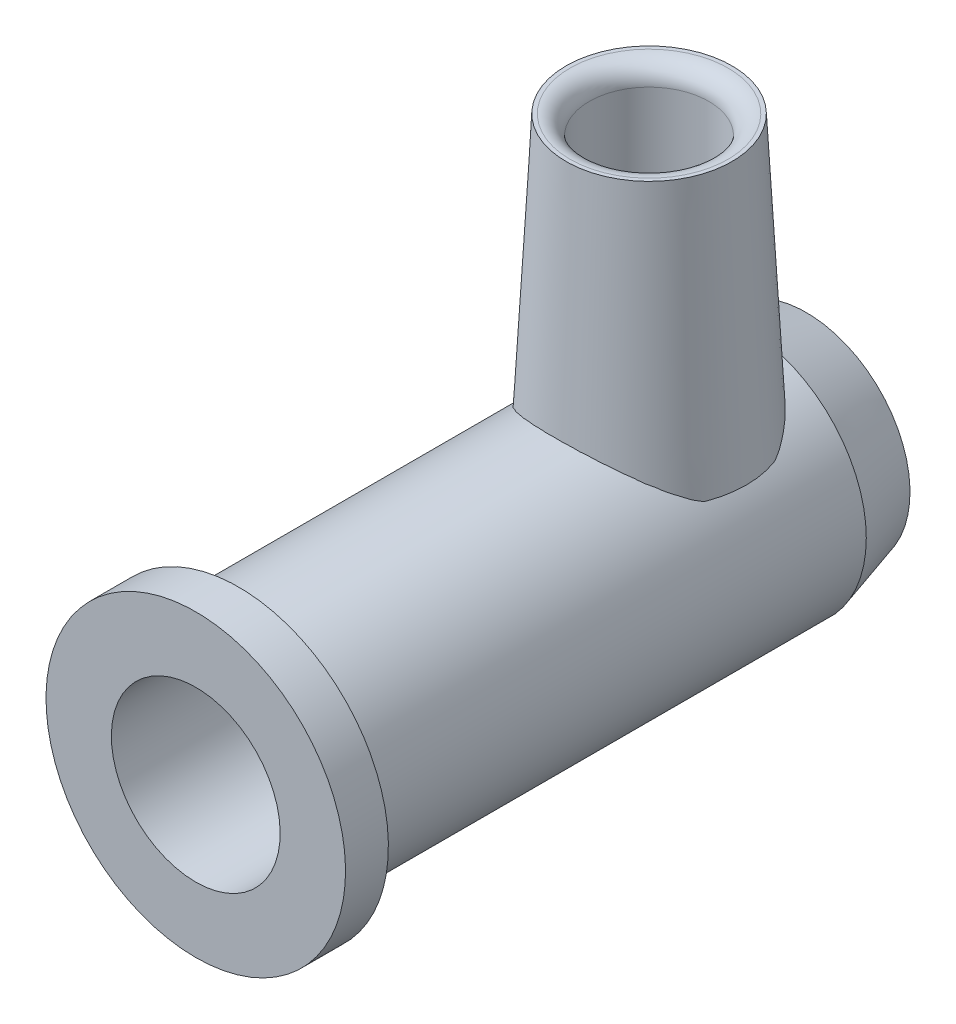
from build123d import *

# Parameters (mm, degrees)
BOSS_EXTRUDE1_DEPTH           = 1
CUT_EXTRUDE1_DEPTH            = 8.5
SKETCH12_R                    = 3.045
SKETCH12_R_2                  = 2.23165
BOSS_EXTRUDE2_DEPTH           = 8.69
SKETCH15_R                    = 3.552
SKETCH15_R_2                  = 2.23165
BOSS_EXTRUDE4_DEPTH           = 8.69
BOSS_EXTRUDE4_TAPER           = 3
BOSS_EXTRUDE4_OTHER_WAY_DEPTH = 1.5
BOSS_EXTRUDE4_OTHER_WAY_TAPER = -3
FILLET2_R                     = 0.7185


with BuildPart() as part:
    # Sketch1 → Revolve1 (revolve)
    with BuildSketch(Plane.YZ):
        Polygon((10.985518673, 23.682686896), (13.425518673, 23.682686896), (13.425518673, 0.892686896), (12.705518673, 0.892686896), (12.03485673, 3.194686896), (12.03485673, 22.082686896), (10.985518673, 22.082686896), align=None)
    revolve(axis=Axis((0, 16.575518673, 25.765129309), (0, 0, -1)))

    # Sketch7 → Boss-Extrude1 (add)
    with BuildSketch(Plane(origin=(0, 21.116180616, 0.892686896), x_dir=(1, 0, 0), z_dir=(0, 1, 0))):
        with BuildLine():
            ThreePointArc((2.23165, -5.87), (1.578014848, -4.291985152), (0, -3.63835))
            ThreePointArc((0, -3.63835), (-1.578014848, -7.448014848), (2.23165, -5.87))
        make_face()
        with BuildLine():
            ThreePointArc((1.54, -5.87), (-1.088944443, -6.958944443), (0, -4.33))
            ThreePointArc((0, -4.33), (1.088944443, -4.781055557), (1.54, -5.87))
        make_face(mode=Mode.SUBTRACT)
    extrude(amount=-BOSS_EXTRUDE1_DEPTH)

    # Sketch7<4> → Cut-Extrude1 (cut)
    with BuildSketch(Plane(origin=(0, 21.116180616, 0.892686896), x_dir=(1, 0, 0), z_dir=(0, 1, 0))):
        with BuildLine():
            ThreePointArc((1.54, -5.87), (1.088944443, -4.781055557), (0, -4.33))
            ThreePointArc((0, -4.33), (-1.088944443, -6.958944443), (1.54, -5.87))
        make_face()
    extrude(amount=-CUT_EXTRUDE1_DEPTH, mode=Mode.SUBTRACT)


with BuildPart() as body_2:
    # Sketch12 → Boss-Extrude2 (new body)
    with BuildSketch(Plane(origin=(0, 21.116180616, 0), x_dir=(-1, 0, 0), z_dir=(0, 1, 0))):
        with Locations((0, 6.762686896)):
            Circle(SKETCH12_R)
        with Locations((0, 6.762686896)):
            Circle(SKETCH12_R_2, mode=Mode.SUBTRACT)
    extrude(amount=BOSS_EXTRUDE2_DEPTH)

    # Sketch15 → Boss-Extrude4 (add)
    with BuildSketch(Plane(origin=(0, 21.116180616, 0.892686896), x_dir=(1, 0, 0), z_dir=(0, 1, 0))):
        with Locations((0, -5.87)):
            Circle(SKETCH15_R)
        with Locations((0, -5.87)):
            Circle(SKETCH15_R_2, mode=Mode.SUBTRACT)
    extrude(amount=BOSS_EXTRUDE4_DEPTH, taper=BOSS_EXTRUDE4_TAPER)

    # Sketch15 → Boss-Extrude4 other way (add)
    with BuildSketch(Plane(origin=(0, 21.116180616, 0.892686896), x_dir=(1, 0, 0), z_dir=(0, 1, 0))):
        with Locations((0, -5.87)):
            Circle(SKETCH15_R)
        with Locations((0, -5.87)):
            Circle(SKETCH15_R_2, mode=Mode.SUBTRACT)
    extrude(amount=-BOSS_EXTRUDE4_OTHER_WAY_DEPTH, taper=BOSS_EXTRUDE4_OTHER_WAY_TAPER)

    # Fillet2
    fillet2_edges = [body_2.edges().sort_by_distance(p)[0] for p in [
        (2.23165, 29.806180616, 6.762686896),
    ]]
    fillet(fillet2_edges, radius=FILLET2_R)


solid = Compound([part.part, body_2.part])
